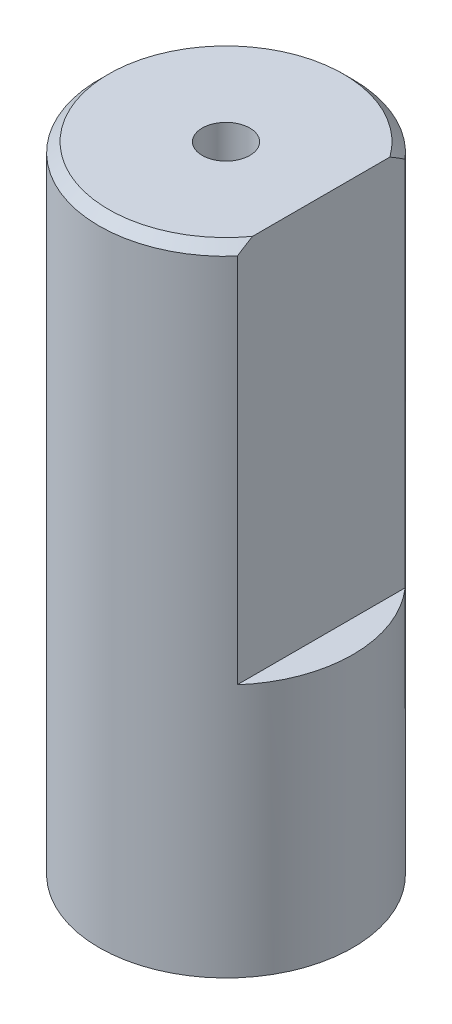
from build123d import *

# Parameters (mm, degrees)
SKETCH2_R           = 4
BOSS_EXTRUDE1_DEPTH = 20
SKETCH3_W           = 1
SKETCH3_H           = 12
CUT_EXTRUDE2_DEPTH  = 10
CHAMFER1_SIZE       = 0.3
SKETCH4_R           = 0.75
CUT_EXTRUDE3_DEPTH  = 20


with BuildPart() as part:
    # Sketch2 → Boss-Extrude1 (new body)
    with BuildSketch(Plane(origin=(0, 0, 0), x_dir=(1, 0, 0), z_dir=(0, 1, 0))):
        with Locations(Location((0, 0, 0), (0, 0, 270))):
            Circle(SKETCH2_R)
    extrude(amount=BOSS_EXTRUDE1_DEPTH)

    # Sketch3 → Cut-Extrude2 (cut, symmetric)
    with BuildSketch(Plane.XY):
        with Locations((3.5, 14)):
            Rectangle(SKETCH3_W, SKETCH3_H)
    extrude(amount=CUT_EXTRUDE2_DEPTH, both=True, mode=Mode.SUBTRACT)

    # Chamfer1
    chamfer1_edges = [part.edges().sort_by_distance(p)[0] for p in [
        (-3.645751311, 20, -1.645751311),
    ]]
    chamfer(chamfer1_edges, length=CHAMFER1_SIZE)

    # Sketch4 → Cut-Extrude3 (cut)
    with BuildSketch(Plane(origin=(0, 20, 0), x_dir=(1, 0, 0), z_dir=(0, 1, 0))):
        with Locations(Location((0, 0, 0), (0, 0, 270))):
            Circle(SKETCH4_R)
    extrude(amount=-CUT_EXTRUDE3_DEPTH, mode=Mode.SUBTRACT)


solid = part.part
